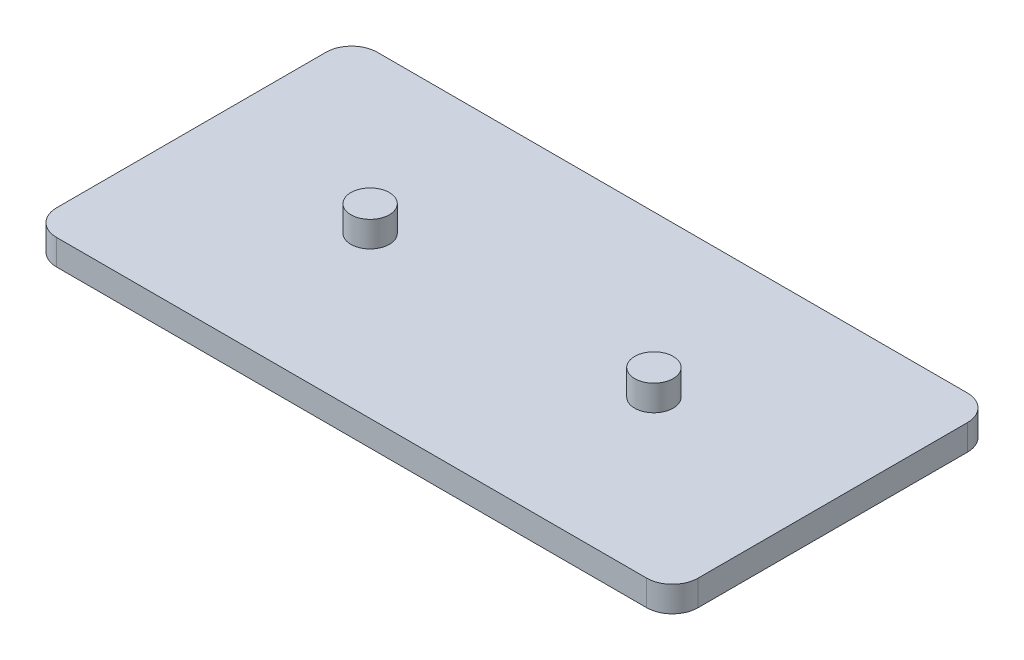
from build123d import *

# Parameters (mm, degrees)
SKETCH1_W           = 635
SKETCH1_H           = 317.5
BOSS_EXTRUDE1_DEPTH = 25.4
SKETCH2_R           = 19.05
BOSS_EXTRUDE2_DEPTH = 25.4
FILLET1_R           = 25.4


with BuildPart() as part:
    # Sketch1 → Boss-Extrude1 (new body)
    with BuildSketch(Plane(origin=(0, 0, 0), x_dir=(1, 0, 0), z_dir=(0, 1, 0))):
        Rectangle(SKETCH1_W, SKETCH1_H)
    extrude(amount=BOSS_EXTRUDE1_DEPTH)

    # Sketch2 → Boss-Extrude2 (add)
    with BuildSketch(Plane(origin=(0, 25.4, 0), x_dir=(1, 0, 0), z_dir=(0, 1, 0))):
        with Locations(Location((-140.462, 0, 0), (0, 0, 270))):
            Circle(SKETCH2_R)
        with Locations(Location((140.462, 0, 0), (0, 0, 90))):
            Circle(SKETCH2_R)
    extrude(amount=BOSS_EXTRUDE2_DEPTH)

    # Fillet1
    fillet1_edges = [part.edges().sort_by_distance(p)[0] for p in [
        (317.5, 12.7, 158.75),
        (-317.5, 12.7, 158.75),
        (-317.5, 12.7, -158.75),
        (317.5, 12.7, -158.75),
    ]]
    fillet(fillet1_edges, radius=FILLET1_R)


solid = part.part
